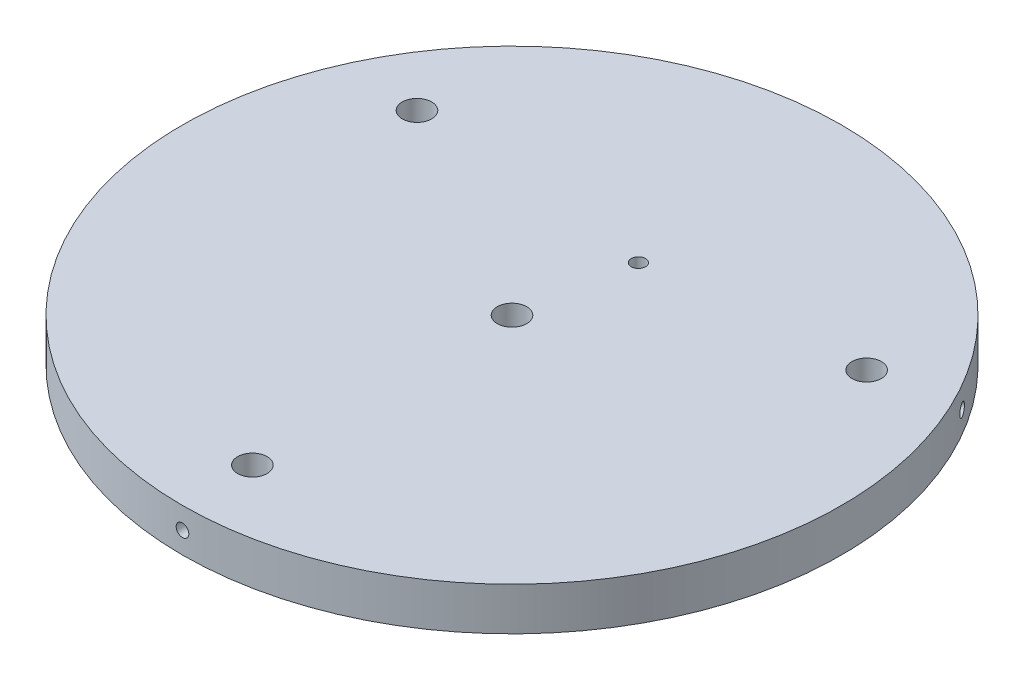
from build123d import *

# Parameters (mm, degrees)
SKETCH1_R               = 73.025
SKETCH1_R_2             = 3.2639
BOSS_EXTRUDE1_DEPTH     = 9.525
SKETCH4_R               = 1.397
CUT_EXTRUDE1_DEPTH      = 6.35
CIRPATTERN1_COUNT       = 3
CUT_EXTRUDE2_DEPTH      = 104.711267016
CUT_EXTRUDE2_DEPTH_BACK = 104.711267016
SKETCH5_R               = 1.5875


with BuildPart() as part:
    # Sketch1 → Boss-Extrude1 (new body)
    with BuildSketch(Plane(origin=(0, 0, 0), x_dir=(1, 0, 0), z_dir=(0, 1, 0))):
        with Locations(Location((0, 0, 0), (0, 0, 90))):
            Circle(SKETCH1_R)
        with Locations(Location((-49.823307505, 28.7655, 0), (0, 0, 90))):
            Circle(SKETCH1_R_2, mode=Mode.SUBTRACT)
        with Locations(Location((49.823307505, 28.7655, 0), (0, 0, 90))):
            Circle(SKETCH1_R_2, mode=Mode.SUBTRACT)
        with Locations(Location((0, -57.531, 0), (0, 0, 90))):
            Circle(SKETCH1_R_2, mode=Mode.SUBTRACT)
        with Locations(Location((0, 0, 0), (0, 0, 90))):
            Circle(SKETCH1_R_2, mode=Mode.SUBTRACT)
    extrude(amount=BOSS_EXTRUDE1_DEPTH)

    # Sketch4 → Cut-Extrude1 (cut)
    with BuildSketch(Plane.XY.offset(73.025)):
        with Locations((0, 4.7625)):
            Circle(SKETCH4_R)
    cut_extrude1 = extrude(amount=-CUT_EXTRUDE1_DEPTH, mode=Mode.SUBTRACT)

    # CirPattern1: Cut-Extrude1 ×3 about axis
    cirpattern1_axis = Axis((0, 0, 0), (0, 1, 0))
    for i in range(1, CIRPATTERN1_COUNT):
        add(cut_extrude1.rotate(cirpattern1_axis, i * 360 / CIRPATTERN1_COUNT), mode=Mode.SUBTRACT)

    # Sketch5 → Cut-Extrude2 (cut, two sides: drawn at the far end of the back side and taken through both)
    with BuildSketch(Plane(origin=(0, 9.525, 0), x_dir=(1, 0, 0), z_dir=(0, 1, 0)).offset(-CUT_EXTRUDE2_DEPTH_BACK)):
        with Locations(Location((3.918177901, 24.089251357, 0), (0, 0, 270))):
            Circle(SKETCH5_R)
    extrude(amount=CUT_EXTRUDE2_DEPTH + CUT_EXTRUDE2_DEPTH_BACK, mode=Mode.SUBTRACT)


solid = part.part
